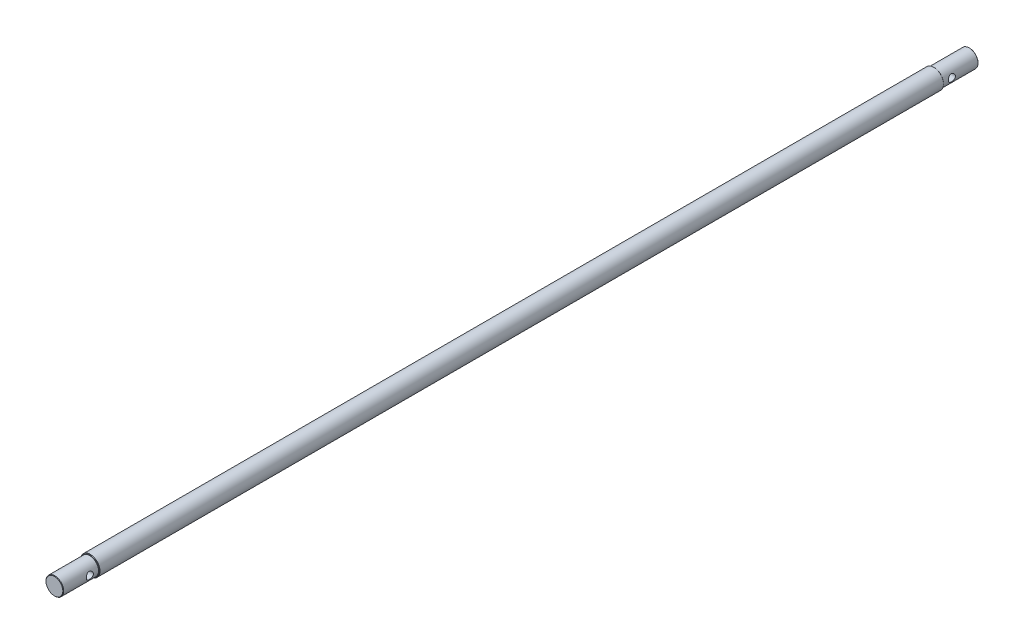
from build123d import *

# Parameters (mm, degrees)
SKETCH_2_R          = 4
CUT_EXTRUDE_1_DEPTH = 1035.271724452
SKETCH_3_R          = 4
CUT_EXTRUDE_2_DEPTH = 1035.271724452
FILLET_1_R          = 0.2
CHAMFER_1_SIZE      = 0.5


with BuildPart() as part:
    # Эскиз1 → Повернуть1 (revolve)
    with BuildSketch(Plane(origin=(0, 0, 0), x_dir=(0, 0, -1), z_dir=(1, 0, 0)), mode=Mode.PRIVATE) as revolve_1_sk:
        Polygon((0, 0), (0, 10), (40, 10), (40, 11), (994, 11), (994, 10), (1034, 10), (1034, 0), align=None)
    revolve(revolve_1_sk.sketch.rotate(Axis((0, 0, 0), (0, 0, -1)), 90), axis=Axis((0, 0, 0), (0, 0, -1)))

    # Эскиз2 → Вырез-Вытянуть1 (cut, through all)
    with BuildSketch(Plane.ZY.offset(10)):
        with Locations((-30, 0)):
            Circle(SKETCH_2_R)
    extrude(amount=-CUT_EXTRUDE_1_DEPTH, mode=Mode.SUBTRACT)

    # Эскиз3 → Вырез-Вытянуть2 (cut, through all)
    with BuildSketch(Plane.ZY.offset(10)):
        with Locations((-1004, 0)):
            Circle(SKETCH_3_R)
    extrude(amount=-CUT_EXTRUDE_2_DEPTH, mode=Mode.SUBTRACT)

    # Скругление1
    fillet_1_edges = [part.edges().sort_by_distance(p)[0] for p in [
        (-10, 0, -994),
        (-10, 0, -40),
    ]]
    fillet(fillet_1_edges, radius=FILLET_1_R)

    # Фаска1
    chamfer_1_edges = [part.edges().sort_by_distance(p)[0] for p in [
        (-10, 0, -1034),
        (-11, 0, -994),
        (-11, 0, -40),
        (-10, 0, 0),
    ]]
    chamfer(chamfer_1_edges, length=CHAMFER_1_SIZE)


solid = part.part
